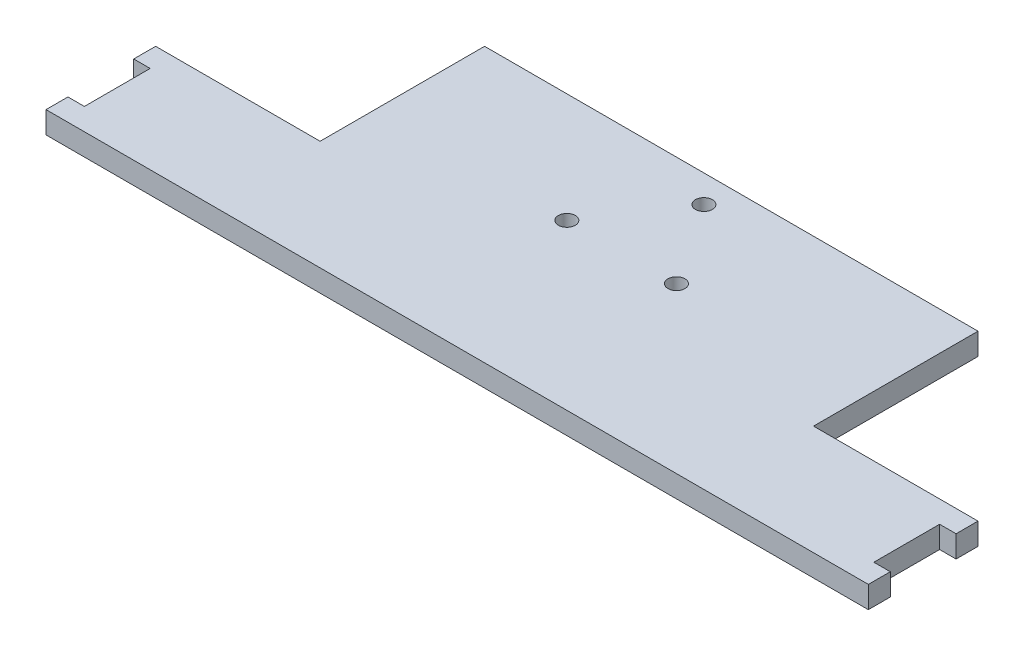
from build123d import *

# Parameters (mm, degrees)
CROQUIS1_W              = 250
CROQUIS1_H              = 250
CROQUIS1_R              = 2.5
SALIENTE_EXTRUIR1_DEPTH = 4
CORTAR_EXTRUIR1_DEPTH   = 4
CROQUIS3_W              = 150
CROQUIS3_H              = 150
CROQUIS3_W_2            = 100
CROQUIS3_H_2            = 100
SALIENTE_EXTRUIR2_DEPTH = 4
CROQUIS4_R              = 1.55
CORTAR_EXTRUIR2_DEPTH   = 10
CROQUIS5_W              = 150
CROQUIS5_H              = 150
CROQUIS5_W_2            = 100
CROQUIS5_H_2            = 100
CORTAR_EXTRUIR3_DEPTH   = 10
CROQUIS6_W              = 30
CROQUIS6_H              = 50
CROQUIS6_W_2            = 50
CROQUIS6_H_2            = 30
CORTAR_EXTRUIR4_DEPTH   = 10
CROQUIS8_R              = 1.55
CORTAR_EXTRUIR5_DEPTH   = 10
CROQUIS9_R              = 2.5
CROQUIS9_R_2            = 1.55
CORTAR_EXTRUIR7_DEPTH   = 10
CORTAR_EXTRUIR8_DEPTH   = 10


with BuildPart() as part:
    # Croquis1 → Saliente-Extruir1 (new body)
    with BuildSketch(Plane(origin=(0, 0, 0), x_dir=(1, 0, 0), z_dir=(0, 1, 0))):
        with Locations((125, 125)):
            Rectangle(CROQUIS1_W, CROQUIS1_H)
        with Locations(Location((40, 210, 0), (0, 0, 270))):
            Circle(CROQUIS1_R, mode=Mode.SUBTRACT)
        with Locations(Location((210, 210, 0), (0, 0, 270))):
            Circle(CROQUIS1_R, mode=Mode.SUBTRACT)
        with Locations(Location((210, 40, 0), (0, 0, 270))):
            Circle(CROQUIS1_R, mode=Mode.SUBTRACT)
        with Locations(Location((40, 40, 0), (0, 0, 270))):
            Circle(CROQUIS1_R, mode=Mode.SUBTRACT)
    extrude(amount=SALIENTE_EXTRUIR1_DEPTH)

    # Croquis2 → Cortar-Extruir1 (cut)
    with BuildSketch(Plane(origin=(0, 4, 0), x_dir=(1, 0, 0), z_dir=(0, 1, 0))):
        Polygon((50, 50), (200, 50), (200, 200), (50, 200), (50, 150.09044268), align=None)
    extrude(amount=-CORTAR_EXTRUIR1_DEPTH, mode=Mode.SUBTRACT)

    # Croquis3 → Saliente-Extruir2 (add)
    with BuildSketch(Plane(origin=(0, 4, 0), x_dir=(1, 0, 0), z_dir=(0, 1, 0))):
        with Locations((125, 125)):
            Rectangle(CROQUIS3_W, CROQUIS3_H)
        with Locations((125, 125)):
            Rectangle(CROQUIS3_W_2, CROQUIS3_H_2, mode=Mode.SUBTRACT)
    extrude(amount=-SALIENTE_EXTRUIR2_DEPTH)

    # Croquis4 → Cortar-Extruir2 (cut)
    with BuildSketch(Plane(origin=(0, 4, 0), x_dir=(1, 0, 0), z_dir=(0, 1, 0))):
        with Locations(Location((115, 20, 0), (0, 0, 270))):
            Circle(CROQUIS4_R)
        with Locations(Location((135, 20, 0), (0, 0, 270))):
            Circle(CROQUIS4_R)
        with Locations(Location((125, 5, 0), (0, 0, 270))):
            Circle(CROQUIS4_R)
    extrude(amount=-CORTAR_EXTRUIR2_DEPTH, mode=Mode.SUBTRACT)

    # Croquis5 → Cortar-Extruir3 (cut)
    with BuildSketch(Plane(origin=(0, 4, 0), x_dir=(1, 0, 0), z_dir=(0, 1, 0))):
        with Locations((125, 125)):
            Rectangle(CROQUIS5_W, CROQUIS5_H)
        with Locations((125, 125)):
            Rectangle(CROQUIS5_W_2, CROQUIS5_H_2, mode=Mode.SUBTRACT)
    extrude(amount=-CORTAR_EXTRUIR3_DEPTH, mode=Mode.SUBTRACT)

    # Croquis6 → Cortar-Extruir4 (cut)
    with BuildSketch(Plane(origin=(0, 4, 0), x_dir=(1, 0, 0), z_dir=(0, 1, 0))):
        Polygon((170, 0), (250, 0), (250, 30), (220, 30), (170, 30), align=None)
        with Locations((235, 55)):
            Rectangle(CROQUIS6_W, CROQUIS6_H)
        Polygon((0, 80), (0, 0), (30, 0), (30, 30), (30, 80), align=None)
        with Locations((55, 15)):
            Rectangle(CROQUIS6_W_2, CROQUIS6_H_2)
        Polygon((80, 250), (0, 250), (0, 220), (30, 220), (80, 220), align=None)
        with Locations((15, 195)):
            Rectangle(CROQUIS6_W, CROQUIS6_H)
        Polygon((250, 170), (250, 250), (220, 250), (220, 220), (220, 170), align=None)
        with Locations((195, 235)):
            Rectangle(CROQUIS6_W_2, CROQUIS6_H_2)
    extrude(amount=-CORTAR_EXTRUIR4_DEPTH, mode=Mode.SUBTRACT)

    # Croquis8 → Cortar-Extruir5 (cut)
    with BuildSketch(Plane(origin=(0, 4, 0), x_dir=(1, 0, 0), z_dir=(0, 1, 0))):
        with Locations(Location((125, 5, 0), (0, 0, 270))):
            Circle(CROQUIS8_R)
        with Locations(Location((135, 20, 0), (0, 0, 270))):
            Circle(CROQUIS8_R)
        with Locations(Location((115, 20, 0), (0, 0, 270))):
            Circle(CROQUIS8_R)
        with Locations(Location((20, 135, 0), (0, 0, 270))):
            Circle(CROQUIS8_R)
        with Locations(Location((5, 125, 0), (0, 0, 270))):
            Circle(CROQUIS8_R)
        with Locations(Location((20, 115, 0), (0, 0, 270))):
            Circle(CROQUIS8_R)
        with Locations(Location((135, 230, 0), (0, 0, 270))):
            Circle(CROQUIS8_R)
        with Locations(Location((125, 245, 0), (0, 0, 270))):
            Circle(CROQUIS8_R)
        with Locations(Location((115, 230, 0), (0, 0, 270))):
            Circle(CROQUIS8_R)
        with Locations(Location((230, 115, 0), (0, 0, 270))):
            Circle(CROQUIS8_R)
        with Locations(Location((245, 125, 0), (0, 0, 270))):
            Circle(CROQUIS8_R)
        with Locations(Location((230, 135, 0), (0, 0, 270))):
            Circle(CROQUIS8_R)
    extrude(amount=-CORTAR_EXTRUIR5_DEPTH, mode=Mode.SUBTRACT)

    # Croquis9 → Cortar-Extruir7 (cut)
    # profile 1 of 2: a face of its own
    with BuildSketch(Plane(origin=(0, 4, 0), x_dir=(1, 0, 0), z_dir=(0, 1, 0))):
        Polygon((30, 30), (50, 30), (50, 34), (53, 34), (53, 46), (50, 46), (50, 50), (50, 200), (50, 204), (53, 204), (53, 216), (50, 216), (50, 220), (30, 220), (30, 170), (0, 170), (0, 80), (30, 80), align=None)
        with Locations((40, 40)):
            Circle(CROQUIS9_R, mode=Mode.SUBTRACT)
        with Locations((20, 115)):
            Circle(CROQUIS9_R_2, mode=Mode.SUBTRACT)
        with Locations((5, 125)):
            Circle(CROQUIS9_R_2, mode=Mode.SUBTRACT)
        with Locations((20, 135)):
            Circle(CROQUIS9_R_2, mode=Mode.SUBTRACT)
        with Locations((40, 210)):
            Circle(CROQUIS9_R, mode=Mode.SUBTRACT)
    # profile 2 of 2: a face of its own
    with BuildSketch(Plane(origin=(0, 4, 0), x_dir=(1, 0, 0), z_dir=(0, 1, 0))):
        Polygon((200, 0), (250, 0), (250, 250), (200, 250), (200, 216), (197, 216), (197, 204), (200, 204), (200, 46), (197, 46), (197, 34), (200, 34), align=None)
    extrude(amount=-CORTAR_EXTRUIR7_DEPTH, mode=Mode.SUBTRACT)


with BuildPart() as cortar_extruir7_piece_1:
    # of the separate pieces the step leaves, piece 1, a body of its own (cortar_extruir7_pieces)
    add(part.part.solids().sort_by_distance((80, 0, 0))[0])

    # Croquis10 → Cortar-Extruir8 (cut)
    with BuildSketch(Plane(origin=(0, 4, 0), x_dir=(1, 0, 0), z_dir=(0, 1, 0))):
        Polygon((200, 50), (50, 50), (50, 46), (53, 46), (53, 34), (50, 34), (50, 30), (80, 30), (80, 0), (170, 0), (170, 30), (200, 30), (200, 34), (197, 34), (197, 46), (200, 46), align=None)
    extrude(amount=-CORTAR_EXTRUIR8_DEPTH, mode=Mode.SUBTRACT)


with BuildPart() as cortar_extruir7_piece_2:
    # of the separate pieces the step leaves, piece 2, a body of its own (cortar_extruir7_pieces)
    add(part.part.solids().sort_by_distance((50, 0, -200))[0])


solid = cortar_extruir7_piece_2.part
